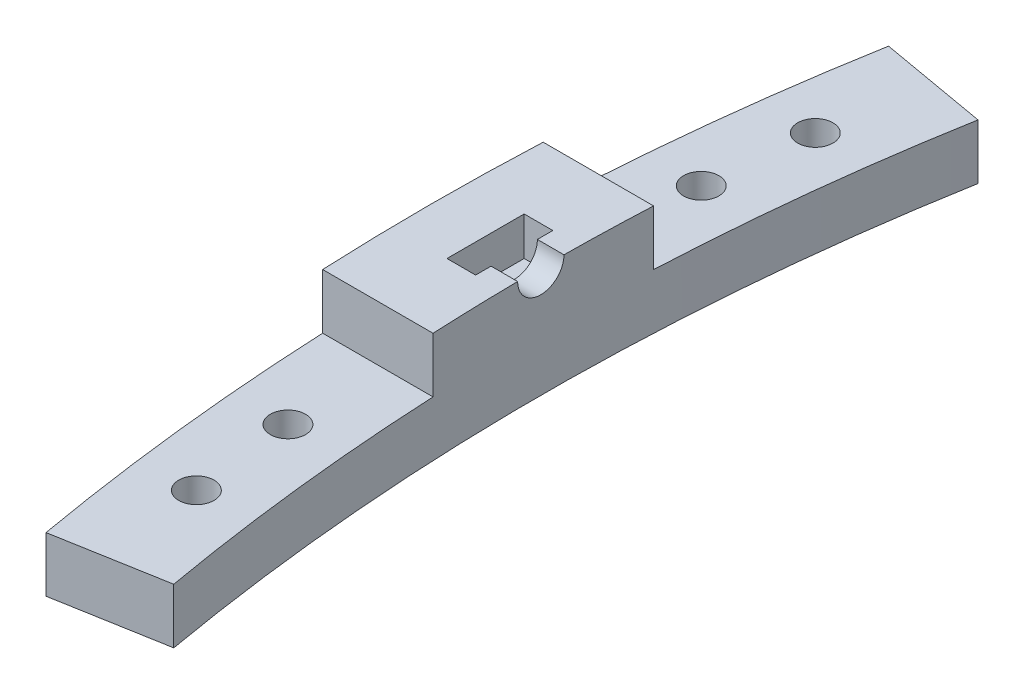
from build123d import *

# Parameters (mm, degrees)
BOSS_EXTRUDE1_DEPTH        = 5
F_3_2_3_2_DIAMETER_HOLE1_D = 3.2
BOSS_EXTRUDE2_DEPTH        = 5
SKETCH10_W                 = 7
SKETCH10_H                 = 7
CUT_EXTRUDE2_DEPTH         = 2.6
SKETCH11_R                 = 2.1
CUT_EXTRUDE3_DEPTH         = 41.33014714


with BuildPart() as part:
    # Sketch1 → Boss-Extrude1 (new body)
    with BuildSketch(Plane(origin=(0, 0, 0), x_dir=(1, 0, 0), z_dir=(0, 1, 0))):
        with BuildLine():
            Line((-216.657705663, 38.202599087), (-206.809628133, 36.46611731))
            ThreePointArc((-206.809628133, 36.46611731), (-210, 0), (-206.809628133, -36.46611731))
            Line((-206.809628133, -36.46611731), (-216.657705663, -38.202599087))
            ThreePointArc((-216.657705663, -38.202599087), (-220, 0), (-216.657705663, 38.202599087))
        make_face()
    extrude(amount=BOSS_EXTRUDE1_DEPTH)

    # Ø3.2 (3.2) Diameter Hole1 (through all)
    with Locations(Plane(origin=(0, 0, 0), x_dir=(-1, 0, 0), z_dir=(0, -1, 0))):
        with Locations((214.18186009, -18.738484691), (214.18186009, 18.738484691), (213.160645195, -28.063131327), (213.160645195, 28.063131327)):
            Hole(F_3_2_3_2_DIAMETER_HOLE1_D / 2)

    # Sketch9 → Boss-Extrude2 (add)
    with BuildSketch(Plane(origin=(0, 5, 0), x_dir=(1, 0, 0), z_dir=(0, 1, 0))):
        with BuildLine():
            Line((-219.772609758, 10), (-209.761769634, 10))
            ThreePointArc((-209.761769634, 10), (-210, 0), (-209.761769634, -10))
            Line((-209.761769634, -10), (-219.772609758, -10))
            ThreePointArc((-219.772609758, -10), (-220, 0), (-219.772609758, 10))
        make_face()
    extrude(amount=BOSS_EXTRUDE2_DEPTH)

    # Sketch10 → Cut-Extrude2 (cut)
    with BuildSketch(Plane.ZY.offset(215)):
        with Locations((0, 10)):
            Rectangle(SKETCH10_W, SKETCH10_H)
    extrude(amount=-CUT_EXTRUDE2_DEPTH, mode=Mode.SUBTRACT)

    # Sketch11 → Cut-Extrude3 (cut, through all)
    with BuildSketch(Plane.ZY.offset(215)):
        with Locations((0, 10)):
            Circle(SKETCH11_R)
    extrude(amount=-CUT_EXTRUDE3_DEPTH, mode=Mode.SUBTRACT)


solid = part.part
